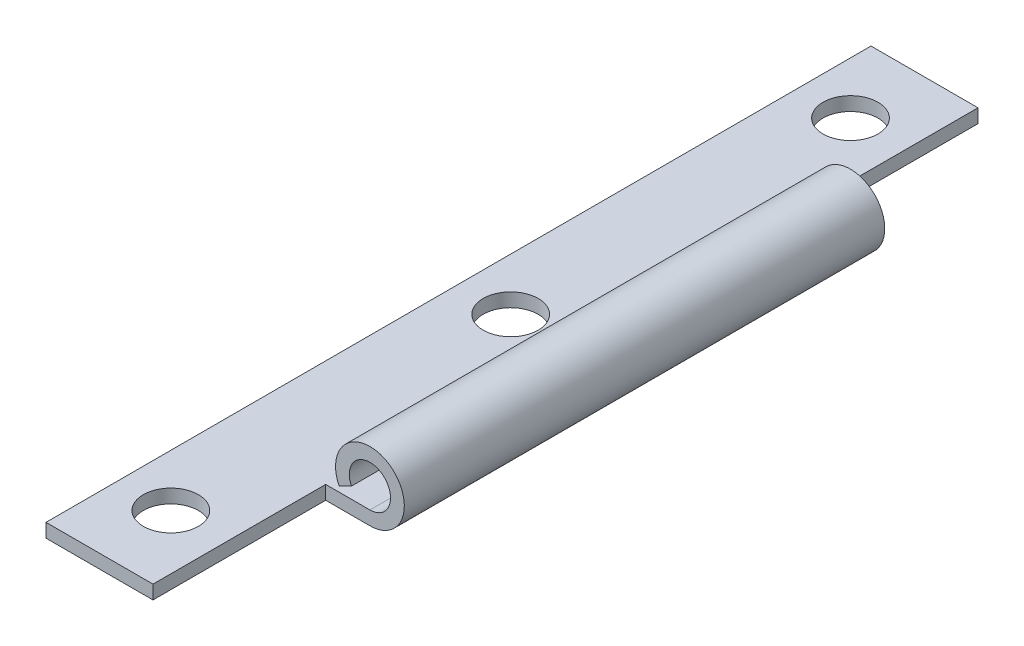
from build123d import *

# Parameters (mm, degrees)
SKETCH3_W          = 60
SKETCH3_H          = 1
SKETCH4_W          = 8.09810269
SKETCH4_H          = 14.216859333
SKETCH4_W_2        = 8.260259714
SKETCH4_H_2        = 13.467623065
CUT_EXTRUDE1_DEPTH = 62.702917273
SKETCH5_R          = 2
CUT_EXTRUDE2_DEPTH = 62.629944021


with BuildPart() as part:
    # Sweep1: sweep along a path in Sketch1
    with BuildLine(Plane.XY) as sweep1_path:
        Line((0, 0), (11, 0))
        ThreePointArc((11, 0), (12.315747679, 4.62574882), (8.762440739, 1.384953564))
    # Sketch3 → Sweep1 (sweep)
    with BuildSketch(Plane(origin=(0, 0, 0), x_dir=(0, 0, -1), z_dir=(1, 0, 0))):
        with Locations((-30, 0.5)):
            Rectangle(SKETCH3_W, SKETCH3_H)
    sweep(path=sweep1_path.line)

    # Sketch4 → Cut-Extrude1 (cut, through all)
    with BuildSketch(Plane(origin=(0, 0, 0), x_dir=(-1, 0, 0), z_dir=(0, -1, 0))):
        with Locations((-11.830088217, -54.549659974)):
            Rectangle(SKETCH4_W, SKETCH4_H)
        with Locations((-11.911166729, -5.766188468)):
            Rectangle(SKETCH4_W_2, SKETCH4_H_2)
    extrude(amount=-CUT_EXTRUDE1_DEPTH, mode=Mode.SUBTRACT)

    # Sketch5 → Cut-Extrude2 (cut, through all)
    with BuildSketch(Plane(origin=(0, 1, 0), x_dir=(1, 0, 0), z_dir=(0, 1, 0))):
        with Locations(Location((3.794583691, -5.285866517, 0), (0, 0, 270))):
            Circle(SKETCH5_R)
        with Locations(Location((3.794583691, -54.714133483, 0), (0, 0, 90))):
            Circle(SKETCH5_R)
        with Locations(Location((3.794583691, -30, 0), (0, 0, 270))):
            Circle(SKETCH5_R)
    extrude(amount=-CUT_EXTRUDE2_DEPTH, mode=Mode.SUBTRACT)


solid = part.part
